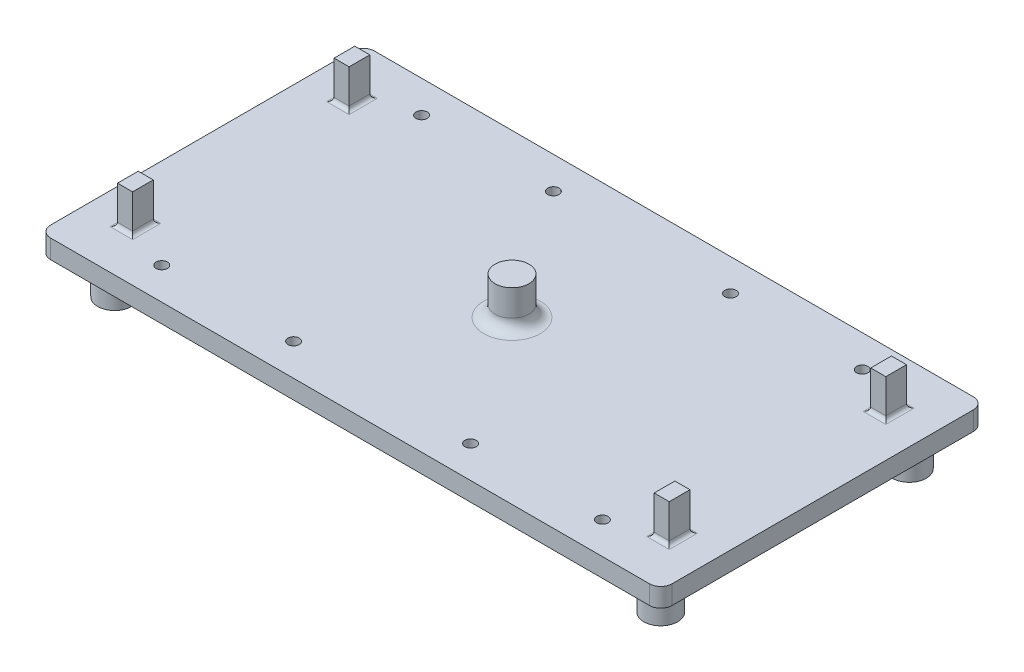
from build123d import *

# Parameters (mm, degrees)
SKETCH1_W            = 165
SKETCH1_H            = 86
BOSS_EXTRUDE1_DEPTH  = 5
SKETCH2_R            = 4.5
BOSS_EXTRUDE2_DEPTH  = 10
FILLET1_R            = 3
SKETCH3_W            = 4
SKETCH3_H            = 5.5
SKETCH3_R            = 4.5
BOSS_EXTRUDE3_DEPTH  = 10
FILLET2_R            = 3
FILLET3_R            = 1
FILLET3_OF_MIRROR1_R = 1
FILLET4_R            = 3
SKETCH4_R            = 1.5
CUT_EXTRUDE1_DEPTH   = 5


with BuildPart() as part:
    # Sketch1 → Boss-Extrude1 (new body)
    with BuildSketch(Plane(origin=(0, 0, 0), x_dir=(1, 0, 0), z_dir=(0, 1, 0))):
        Rectangle(SKETCH1_W, SKETCH1_H)
    extrude(amount=BOSS_EXTRUDE1_DEPTH)

    # Sketch2 → Boss-Extrude2 (add)
    with BuildSketch(Plane.XZ):
        with Locations(Location((-72.5, 33, 0), (0, 0, 90))):
            Circle(SKETCH2_R)
        with Locations(Location((72.5, 33, 0), (0, 0, 90))):
            Circle(SKETCH2_R)
        with Locations(Location((-72.5, -33, 0), (0, 0, 90))):
            Circle(SKETCH2_R)
        with Locations(Location((72.5, -33, 0), (0, 0, 90))):
            Circle(SKETCH2_R)
    extrude(amount=BOSS_EXTRUDE2_DEPTH)

    # Fillet1
    fillet1_edges = [part.edges().sort_by_distance(p)[0] for p in [
        (-72.5, 0, 28.5),
        (72.5, 0, 28.5),
        (72.5, 0, -37.5),
        (-72.5, 0, -37.5),
    ]]
    fillet(fillet1_edges, radius=FILLET1_R)

    # Sketch3 → Boss-Extrude3 (add)
    with BuildSketch(Plane(origin=(0, 5, 0), x_dir=(1, 0, 0), z_dir=(0, 1, 0))):
        with Locations((71.25, -28.75)):
            Rectangle(SKETCH3_W, SKETCH3_H)
        with Locations((71.25, 28.75)):
            Rectangle(SKETCH3_W, SKETCH3_H)
        with Locations(Location((0, 0, 0), (0, 0, 270))):
            Circle(SKETCH3_R)
    boss_extrude3 = extrude(amount=BOSS_EXTRUDE3_DEPTH)

    # Fillet2
    fillet2_edges = [part.edges().sort_by_distance(p)[0] for p in [
        (0, 5, -4.5),
    ]]
    fillet(fillet2_edges, radius=FILLET2_R)

    # Fillet3
    fillet3_edges = [part.edges().sort_by_distance(p)[0] for p in [
        (73.25, 5, 28.75),
        (71.25, 5, 26),
        (69.25, 5, 28.75),
        (71.25, 5, 31.5),
        (73.25, 5, -28.75),
        (71.25, 5, -31.5),
        (69.25, 5, -28.75),
        (71.25, 5, -26),
    ]]
    fillet(fillet3_edges, radius=FILLET3_R)

    # Mirror1: Boss-Extrude3 across plane
    add(boss_extrude3.mirror(Plane(origin=(0, 0, 0), x_dir=(0, 0, 1), z_dir=(1, 0, 0))))

    # Fillet3 of Mirror1
    fillet3_of_mirror1_edges = [part.edges().sort_by_distance(p)[0] for p in [
        (-73.25, 5, 28.75),
        (-71.25, 5, 26),
        (-69.25, 5, 28.75),
        (-71.25, 5, 31.5),
        (-73.25, 5, -28.75),
        (-71.25, 5, -31.5),
        (-69.25, 5, -28.75),
        (-71.25, 5, -26),
    ]]
    fillet(fillet3_of_mirror1_edges, radius=FILLET3_OF_MIRROR1_R)

    # Fillet4
    fillet4_edges = [part.edges().sort_by_distance(p)[0] for p in [
        (82.5, 2.5, 43),
        (-82.5, 2.5, 43),
        (-82.5, 2.5, -43),
        (82.5, 2.5, -43),
    ]]
    fillet(fillet4_edges, radius=FILLET4_R)

    # Sketch4 → Cut-Extrude1 (cut)
    with BuildSketch(Plane(origin=(0, 5, 0), x_dir=(1, 0, 0), z_dir=(0, 1, 0))):
        with Locations(Location((-23.5, -34.5, 0), (0, 0, 270))):
            Circle(SKETCH4_R)
        with Locations(Location((-58.5, -34.5, 0), (0, 0, 270))):
            Circle(SKETCH4_R)
        with Locations(Location((-58.5, 34.5, 0), (0, 0, 270))):
            Circle(SKETCH4_R)
        with Locations(Location((-23.5, 34.5, 0), (0, 0, 270))):
            Circle(SKETCH4_R)
    cut_extrude1 = extrude(amount=-CUT_EXTRUDE1_DEPTH, mode=Mode.SUBTRACT)

    # Mirror2: Cut-Extrude1 across plane
    add(cut_extrude1.mirror(Plane(origin=(0, 0, 0), x_dir=(0, 0, 1), z_dir=(1, 0, 0))), mode=Mode.SUBTRACT)


solid = part.part
